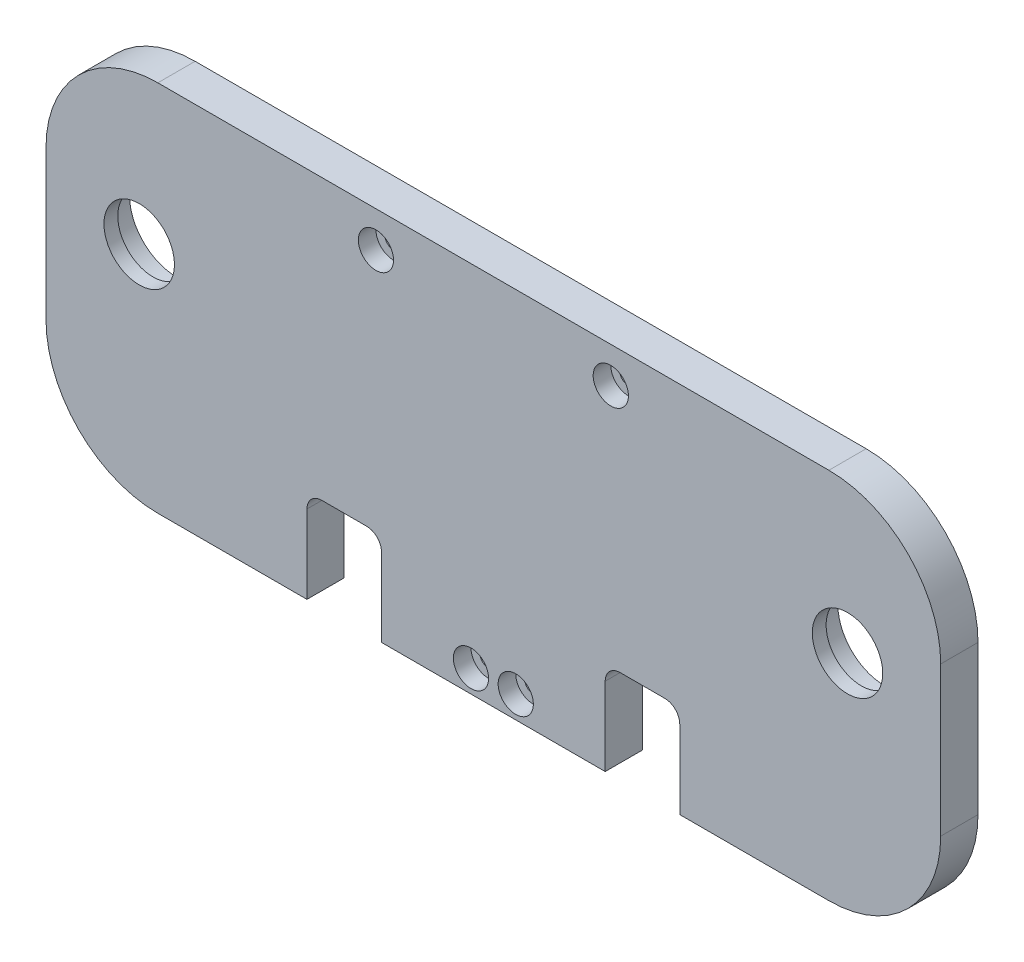
from build123d import *

# Parameters (mm, degrees)
BOSS_EXTRUDE1_DEPTH                                 = 6.35
CBORE_FOR_00_BINDING_HEAD_MACHINE_SCREW_D           = 3.000000096
CBORE_FOR_00_BINDING_HEAD_MACHINE_SCREW_CBORE_D     = 5.999999938
CBORE_FOR_00_BINDING_HEAD_MACHINE_SCREW_CBORE_DEPTH = 3.000000096
SKETCH6_W                                           = 12.7
SKETCH6_H                                           = 15.875
CUT_EXTRUDE1_DEPTH                                  = 6.35
FILLET2_R                                           = 2.54
CBORE_FOR_00_BINDING_HEAD_MACHINE_S_2_D             = 11.999999876
CBORE_FOR_00_BINDING_HEAD_MACHINE_S_2_CBORE_D       = 16.000000004
CBORE_FOR_00_BINDING_HEAD_MACHINE_S_2_CBORE_DEPTH   = 3.999999874


with BuildPart() as part:
    # Sketch1 → Boss-Extrude1 (new body)
    with BuildSketch(Plane.XY):
        with BuildLine():
            Line((-57.15, 31.75), (57.15, 31.75))
            ThreePointArc((57.15, 31.75), (70.620384182, 26.170384182), (76.2, 12.7))
            Line((76.2, 12.7), (76.2, -12.7))
            ThreePointArc((76.2, -12.7), (70.620384182, -26.170384182), (57.15, -31.75))
            Line((57.15, -31.75), (-57.15, -31.75))
            ThreePointArc((-57.15, -31.75), (-70.620384182, -26.170384182), (-76.2, -12.7))
            Line((-76.2, -12.7), (-76.2, 12.7))
            ThreePointArc((-76.2, 12.7), (-70.620384182, 26.170384182), (-57.15, 31.75))
        make_face()
    extrude(amount=BOSS_EXTRUDE1_DEPTH)

    # CBORE for _00 Binding Head Machine Screw (through all)
    with Locations(Plane.XY.offset(6.35)):
        with Locations((-20, 25.65), (20, 25.65), (3.81, -27.94), (-3.81, -27.94)):
            CounterBoreHole(CBORE_FOR_00_BINDING_HEAD_MACHINE_SCREW_D / 2, CBORE_FOR_00_BINDING_HEAD_MACHINE_SCREW_CBORE_D / 2, CBORE_FOR_00_BINDING_HEAD_MACHINE_SCREW_CBORE_DEPTH)

    # Sketch6 → Cut-Extrude1 (cut)
    with BuildSketch(Plane(origin=(0, 0, 0), x_dir=(-1, 0, 0), z_dir=(0, 0, -1))):
        with Locations((-25.4, -23.8125)):
            Rectangle(SKETCH6_W, SKETCH6_H)
        with Locations((25.4, -23.8125)):
            Rectangle(SKETCH6_W, SKETCH6_H)
    extrude(amount=-CUT_EXTRUDE1_DEPTH, mode=Mode.SUBTRACT)

    # Fillet2
    fillet2_edges = [part.edges().sort_by_distance(p)[0] for p in [
        (19.05, -15.875, 3.175),
        (31.75, -15.875, 3.175),
        (-19.05, -15.875, 3.175),
        (-31.75, -15.875, 3.175),
    ]]
    fillet(fillet2_edges, radius=FILLET2_R)

    # CBORE for _00 Binding Head Machine S 2 (through all)
    with Locations(Plane(origin=(0, 0, 0), x_dir=(1, 0, 0), z_dir=(0, 0, -1))):
        with Locations((-60.325, -6.35), (60.325, -6.35)):
            CounterBoreHole(CBORE_FOR_00_BINDING_HEAD_MACHINE_S_2_D / 2, CBORE_FOR_00_BINDING_HEAD_MACHINE_S_2_CBORE_D / 2, CBORE_FOR_00_BINDING_HEAD_MACHINE_S_2_CBORE_DEPTH)


solid = part.part
